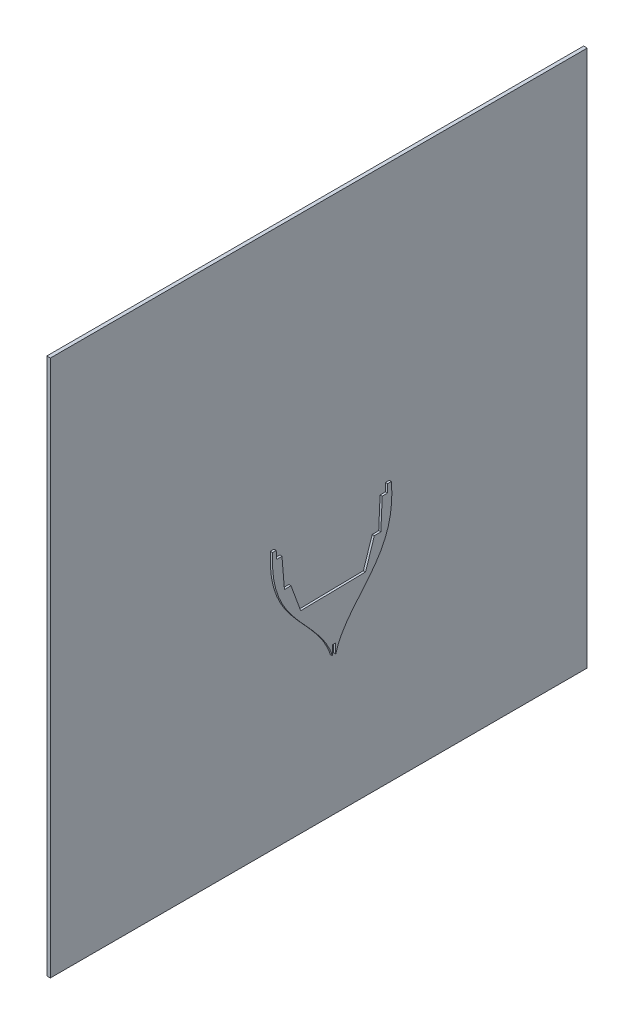
from build123d import *

# Parameters (mm, degrees)
BOSS_EXTRU_2_DEPTH      = 10
BOSS_EXTRU_3_DEPTH      = 6
ENL_V_MAT_EXTRU_1_DEPTH = 6


with BuildPart() as part:
    # Esquisse3D1 → Boss.-Extru.2 (new body)
    with BuildSketch(Plane(origin=(-20, 1121.289346724, 777.274991403), x_dir=(0, -0.7071067811865476, -0.7071067811865476), z_dir=(1, 0, 0))):
        Polygon((0, 0), (1060.66017178, 1060.66017178), (2121.32034356, 0), (1060.66017178, -1060.66017178), align=None)
    extrude(amount=BOSS_EXTRU_2_DEPTH)


with BuildPart() as body_2:
    # Esquisse5 → Boss.-Extru.3 (new body)
    with BuildSketch(Plane(origin=(0, 0, 0), x_dir=(0, 0, -1), z_dir=(1, 0, 0))):
        with BuildLine():
            Line((159.362325519, 362.290262174), (149.362325519, 362.109108401))
            Line((149.362325519, 362.109108401), (148.477293588, 339.534200843))
            Line((148.477293588, 339.534200843), (133.944405585, 339.270932094))
            Line((133.944405585, 339.270932094), (130.123870574, 254.978494084))
            Line((130.123870574, 254.978494084), (111.900779302, 254.648375911))
            Line((111.900779302, 254.648375911), (87.36196664, 179.440825449))
            Line((87.36196664, 179.440825449), (-93.803790533, 176.158939412))
            Line((-93.803790533, 176.158939412), (-121.05043522, 250.428376778))
            Line((-121.05043522, 250.428376778), (-139.273526492, 250.098258605))
            Line((-139.273526492, 250.098258605), (-146.144531522, 334.197015333))
            Line((-146.144531522, 334.197015333), (-160.677419525, 333.933746584))
            Line((-160.677419525, 333.933746584), (-162.379508383, 356.461787474))
            Line((-162.379508383, 356.461787474), (-172.379508383, 356.280633701))
            add(Edge.make_bspline(
                [(0, 0), (-4.007067778, 34.032010809), (-33.561845811, 145.183117288), (-183.782555695, 148.736056381), (-172.379508383, 356.280633701)],
                knots=[0, 0, 0, 0, 0, 1, 1, 1, 1, 1], degree=4))
            add(Edge.make_bspline(
                [(0, 0), (2.771837736, 34.15481324), (28.281457005, 146.30343205), (178.274920872, 155.294864157), (159.362325519, 362.290262174)],
                knots=[0, 0, 0, 0, 0, 1, 1, 1, 1, 1], degree=4))
        make_face()
    extrude(amount=BOSS_EXTRU_3_DEPTH)

    # Esquisse6 → Enlèv. mat.-Extru.1 (cut)
    with BuildSketch(Plane(origin=(6, 0, 0), x_dir=(0, 0, -1), z_dir=(1, 0, 0))):
        Polygon((-4.908549732, 22.471129104), (-5.397664918, 49.471129104), (3.602335082, 49.634167499), (4.091450268, 22.634167499), (117.063261114, -47.52702125), (-85.227699586, -65.220017949), align=None)
    extrude(amount=-ENL_V_MAT_EXTRU_1_DEPTH, mode=Mode.SUBTRACT)


solid = Compound([part.part, body_2.part])
